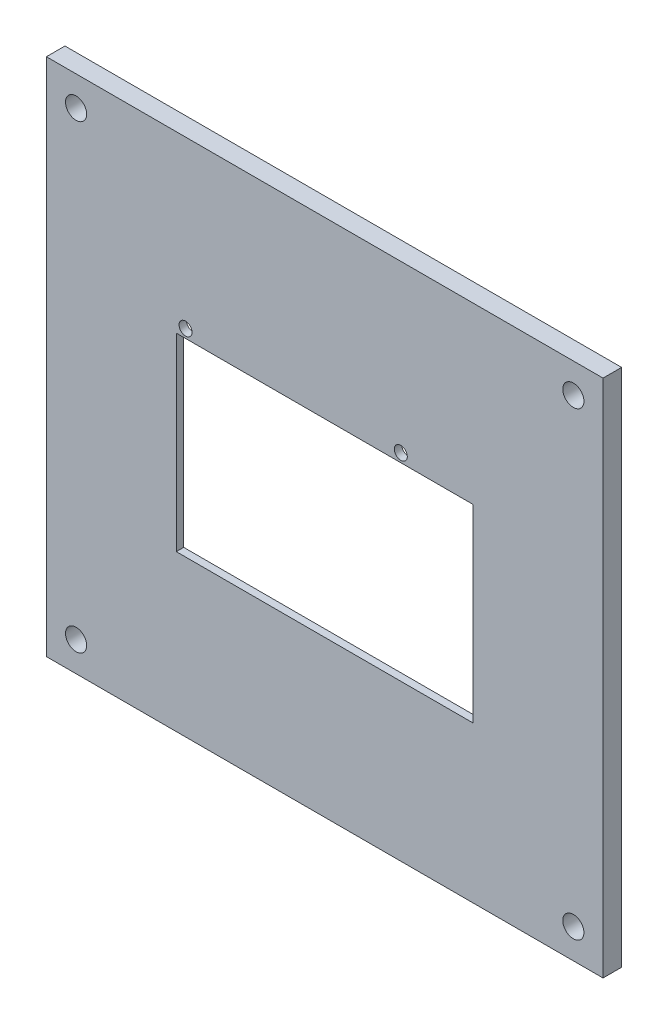
from build123d import *

# Parameters (mm, degrees)
SKETCH1_W           = 150
SKETCH1_H           = 140
SKETCH1_R           = 2.85
SKETCH1_R_2         = 1.75
SKETCH1_W_2         = 80
SKETCH1_H_2         = 51
BOSS_EXTRUDE1_DEPTH = 5
SKETCH2_W           = 100
SKETCH2_H           = 71
SKETCH2_W_2         = 80
SKETCH2_H_2         = 51
CUT_EXTRUDE1_DEPTH  = 3


with BuildPart() as part:
    # Sketch1 → Boss-Extrude1 (new body)
    with BuildSketch(Plane.XY):
        with Locations((3.078431373, -11.336177597)):
            Rectangle(SKETCH1_W, SKETCH1_H)
        with Locations((70.078431373, -73.336177597)):
            Circle(SKETCH1_R, mode=Mode.SUBTRACT)
        with Locations((-63.921568627, -73.336177597)):
            Circle(SKETCH1_R, mode=Mode.SUBTRACT)
        with Locations((-63.921568627, 50.663822403)):
            Circle(SKETCH1_R, mode=Mode.SUBTRACT)
        with Locations((70.078431373, 50.663822403)):
            Circle(SKETCH1_R, mode=Mode.SUBTRACT)
        with Locations((-34.421568627, 13.963822403)):
            Circle(SKETCH1_R_2, mode=Mode.SUBTRACT)
        with Locations((23.578431373, 13.963822403)):
            Circle(SKETCH1_R_2, mode=Mode.SUBTRACT)
        with Locations((3.078431373, -13.836177597)):
            Rectangle(SKETCH1_W_2, SKETCH1_H_2, mode=Mode.SUBTRACT)
    extrude(amount=BOSS_EXTRUDE1_DEPTH)

    # Sketch2 → Cut-Extrude1 (cut)
    with BuildSketch(Plane(origin=(0, 0, 0), x_dir=(-1, 0, 0), z_dir=(0, 0, -1))):
        with Locations((-3.078431373, -13.836177597)):
            Rectangle(SKETCH2_W, SKETCH2_H)
        with Locations((-3.078431373, -13.836177597)):
            Rectangle(SKETCH2_W_2, SKETCH2_H_2, mode=Mode.SUBTRACT)
    extrude(amount=-CUT_EXTRUDE1_DEPTH, mode=Mode.SUBTRACT)


solid = part.part
